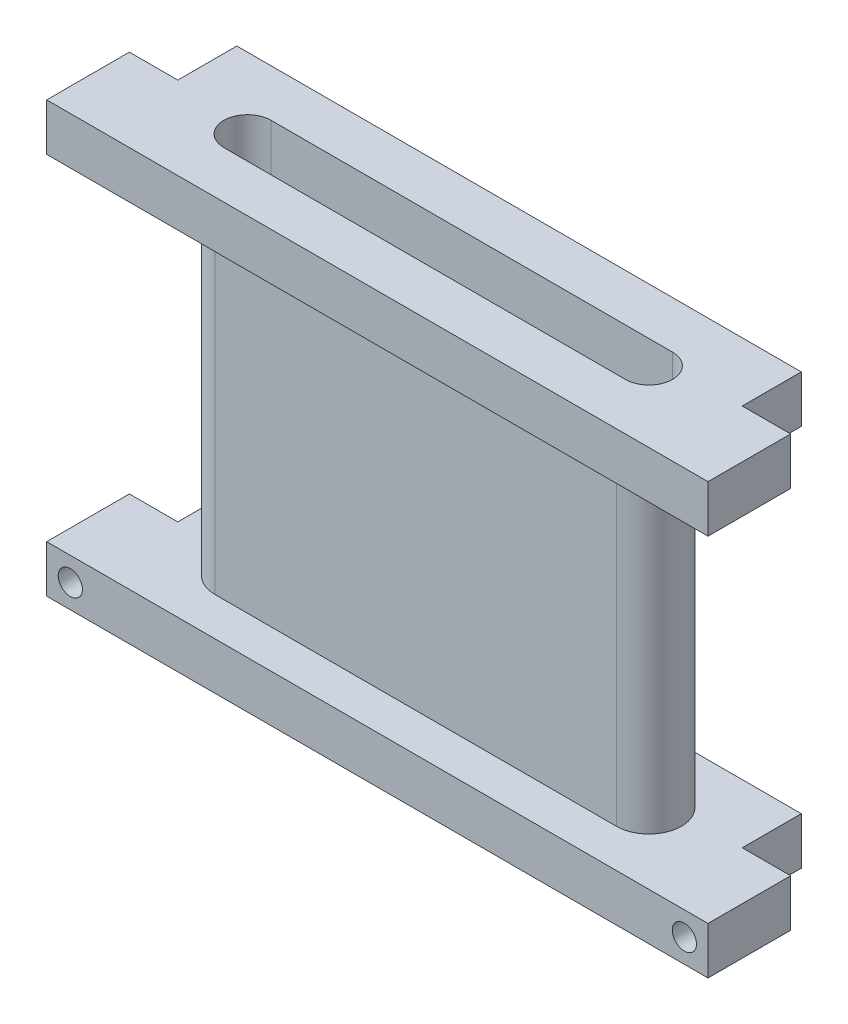
from build123d import *

# Parameters (mm, degrees)
SKETCH1_W                        = 56
SKETCH1_H                        = 8.750000002
BOSS_EXTRUDE1_DEPTH              = 4
BOSS_EXTRUDE2_DEPTH              = 28.4
SKETCH3_W                        = 56
SKETCH3_H                        = 12
BOSS_EXTRUDE3_DEPTH              = 4
SKETCH4_W                        = 56
SKETCH4_H                        = 4
BOSS_EXTRUDE4_DEPTH              = 3.249999998
CUT_EXTRUDE1_REACH               = 48.314
SKETCH5_W                        = 4.100000004
SKETCH5_H                        = 5
CUT_EXTRUDE2_REACH               = 48.314
SKETCH6_W                        = 4.100000004
SKETCH6_H                        = 5.000000001
SKETCH7_W                        = 4.100000004
SKETCH7_H                        = 5.000000001
CUT_EXTRUDE3_DEPTH               = 47.313712872
SKETCH8_W                        = 4.100000004
SKETCH8_H                        = 5
CUT_EXTRUDE4_DEPTH               = 47.313712872
CUT_EXTRUDE5_DEPTH               = 47.313712872
F_2_05_2_05_DIAMETER_HOLE1_D     = 2.05
F_2_05_2_05_DIAMETER_HOLE1_DEPTH = 4
F_2_05_2_05_DIAMETER_HOLE1_TIP   = 0.615882135


with BuildPart() as part:
    # Sketch1 → Boss-Extrude1 (new body)
    with BuildSketch(Plane(origin=(0, 0, 0), x_dir=(1, 0, 0), z_dir=(0, 1, 0))):
        with Locations((0, 1.624999999)):
            Rectangle(SKETCH1_W, SKETCH1_H)
    extrude(amount=-BOSS_EXTRUDE1_DEPTH)

    # Sketch2 → Boss-Extrude2 (add)
    with BuildSketch(Plane(origin=(0, 0, 0), x_dir=(-1, 0, 0), z_dir=(0, 1, 0))):
        with BuildLine():
            Line((-17, 2.75), (17, 2.75))
            ThreePointArc((17, 2.75), (19.75, 0), (17, -2.75))
            Line((17, -2.75), (-17, -2.75))
            ThreePointArc((-17, -2.75), (-19.75, 0), (-17, 2.75))
        make_face()
    extrude(amount=BOSS_EXTRUDE2_DEPTH)

    # Sketch3 → Boss-Extrude3 (add)
    with BuildSketch(Plane.XZ.offset(-28.4)):
        Rectangle(SKETCH3_W, SKETCH3_H)
    extrude(amount=-BOSS_EXTRUDE3_DEPTH)

    # Sketch4 → Boss-Extrude4 (add)
    with BuildSketch(Plane.XY.offset(2.750000002)):
        with Locations((0, -2)):
            Rectangle(SKETCH4_W, SKETCH4_H)
    extrude(amount=BOSS_EXTRUDE4_DEPTH)

    # Sketch5 → Cut-Extrude1 (cut, up to next)
    with BuildSketch(Plane(origin=(0, 32.4, 0), x_dir=(-1, 0, 0), z_dir=(0, 1, 0)), mode=Mode.PRIVATE) as cut_extrude1_sk1:
        with Locations((25.949999998, -3.5)):
            Rectangle(SKETCH5_W, SKETCH5_H)
    cut_extrude1_tool1 = extrude(cut_extrude1_sk1.sketch, amount=-CUT_EXTRUDE1_REACH, mode=Mode.PRIVATE) & part.part
    add(cut_extrude1_tool1.solids().sort_by_distance((-25.95, 32.4, -3.5))[0], mode=Mode.SUBTRACT)

    # Sketch6 → Cut-Extrude2 (cut, up to next)
    with BuildSketch(Plane(origin=(0, 32.4, 0), x_dir=(-1, 0, 0), z_dir=(0, 1, 0)), mode=Mode.PRIVATE) as cut_extrude2_sk1:
        with Locations((-25.949999998, -3.499999999)):
            Rectangle(SKETCH6_W, SKETCH6_H)
    cut_extrude2_tool1 = extrude(cut_extrude2_sk1.sketch, amount=-CUT_EXTRUDE2_REACH, mode=Mode.PRIVATE) & part.part
    add(cut_extrude2_tool1.solids().sort_by_distance((25.95, 32.4, -3.5))[0], mode=Mode.SUBTRACT)

    # Sketch7 → Cut-Extrude3 (cut, through all)
    with BuildSketch(Plane.XZ.offset(4)):
        with Locations((25.949999998, -3.499999999)):
            Rectangle(SKETCH7_W, SKETCH7_H)
    extrude(amount=-CUT_EXTRUDE3_DEPTH, mode=Mode.SUBTRACT)

    # Sketch8 → Cut-Extrude4 (cut, through all)
    with BuildSketch(Plane.XZ.offset(4)):
        with Locations((-25.949999998, -3.5)):
            Rectangle(SKETCH8_W, SKETCH8_H)
    extrude(amount=-CUT_EXTRUDE4_DEPTH, mode=Mode.SUBTRACT)

    # Sketch9 → Cut-Extrude5 (cut, through all)
    with BuildSketch(Plane.XZ.offset(4)):
        with BuildLine():
            Line((-17, -2.000000002), (17, -2.000000002))
            ThreePointArc((17, -2.000000002), (19.000000002, 0), (17, 2.000000002))
            Line((17, 2.000000002), (-17, 2.000000002))
            ThreePointArc((-17, 2.000000002), (-19.000000002, 0), (-17, -2.000000002))
        make_face()
    extrude(amount=-CUT_EXTRUDE5_DEPTH, mode=Mode.SUBTRACT)

    # Ø2.05 (2.05) Diameter Hole1
    with Locations(Plane.XY.offset(6)):
        with Locations((26, -2), (-26, -2)):
            Hole(F_2_05_2_05_DIAMETER_HOLE1_D / 2, depth=F_2_05_2_05_DIAMETER_HOLE1_DEPTH)
            with Locations((0, 0, -(F_2_05_2_05_DIAMETER_HOLE1_DEPTH + F_2_05_2_05_DIAMETER_HOLE1_TIP / 2))):  # 118° drill point
                Cone(0, F_2_05_2_05_DIAMETER_HOLE1_D / 2, F_2_05_2_05_DIAMETER_HOLE1_TIP, mode=Mode.SUBTRACT)


solid = part.part
